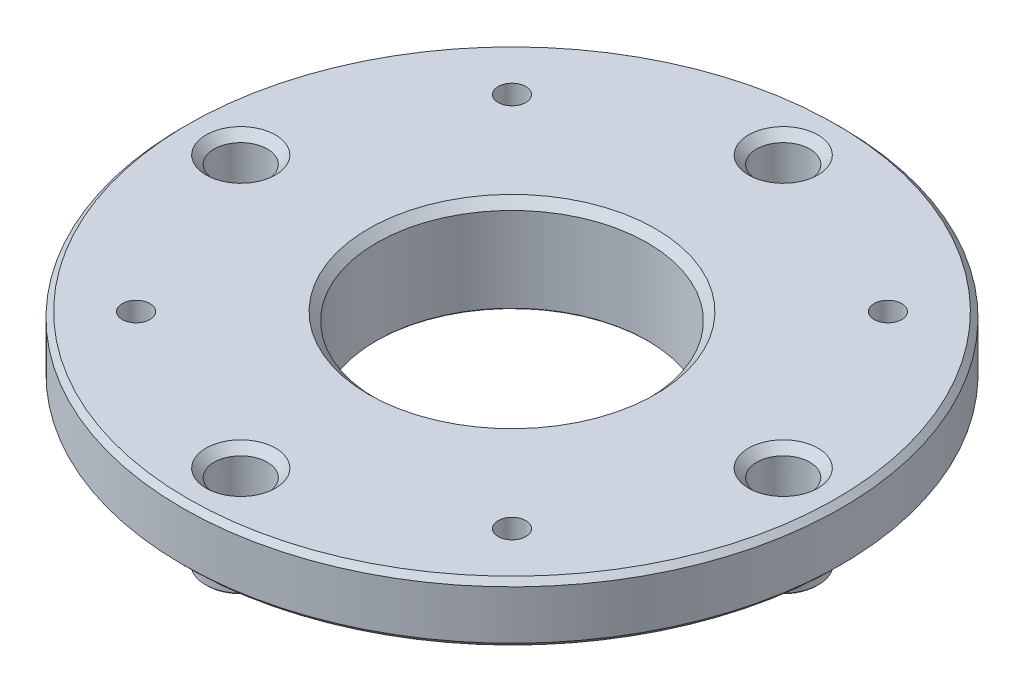
from build123d import *

# Parameters (mm, degrees)
SKETCH1_W                = 60.75
SKETCH1_H                = 11
SKETCH2_R                = 28.485
BOSS_EXTRUDE1_DEPTH      = 6.35
SKETCH3_W                = 6.475
SKETCH3_H                = 4.65
SKETCH4_W                = 6.475
SKETCH4_H                = 4.65
SKETCH5_W                = 6.475
SKETCH5_H                = 4.65
SKETCH6_W                = 6.475
SKETCH6_H                = 4.65
HOLE1_D                  = 5.1054
HOLE1_DEPTH              = 17.35
M8_CLEARANCE_HOLE1_D     = 9.8044
M8_CLEARANCE_HOLE1_DEPTH = 17.35
M45_CLEARANCE_HOLE1_D    = 49.911
M8_CLEARANCE_HOLE2_D     = 9.8044
CHAMFER1_SIZE            = 0.25
CHAMFER2_SIZE            = 1
CHAMFER3_SIZE            = 1.5


with BuildPart() as part:
    # Sketch1 → Revolve1 (revolve)
    with BuildSketch(Plane.XY, mode=Mode.PRIVATE) as revolve1_sk:
        with Locations((30.375, 5.5)):
            Rectangle(SKETCH1_W, SKETCH1_H)
    revolve(revolve1_sk.sketch.rotate(Axis((0, 11, 0), (0, -1, 0)), 270), axis=Axis((0, 11, 0), (0, -1, 0)))

    # Sketch2 → Boss-Extrude1 (add)
    with BuildSketch(Plane.XZ):
        with Locations(Location((0, 0, 0), (0, 0, 270))):
            Circle(SKETCH2_R)
    extrude(amount=BOSS_EXTRUDE1_DEPTH)

    # Sketch3 → Revolve2 (revolve)
    with BuildSketch(Plane(origin=(0, 0, 0), x_dir=(-1, 0, 0), z_dir=(0, 0, -1)), mode=Mode.PRIVATE) as revolve2_sk:
        with Locations((46.7625, -2.325)):
            Rectangle(SKETCH3_W, SKETCH3_H)
    revolve(revolve2_sk.sketch.rotate(Axis((-50, -4.65, 0), (0, 1, 0)), 270), axis=Axis((-50, -4.65, 0), (0, 1, 0)))

    # Sketch4 → Revolve3 (revolve)
    with BuildSketch(Plane(origin=(0, 0, -50), x_dir=(-1, 0, 0), z_dir=(0, 0, -1)), mode=Mode.PRIVATE) as revolve3_sk:
        with Locations((-3.2375, -2.325)):
            Rectangle(SKETCH4_W, SKETCH4_H)
    revolve(revolve3_sk.sketch.rotate(Axis((0, -4.65, -50), (0, 1, 0)), 270), axis=Axis((0, -4.65, -50), (0, 1, 0)))

    # Sketch5 → Revolve4 (revolve)
    with BuildSketch(Plane(origin=(0, 0, 0), x_dir=(-1, 0, 0), z_dir=(0, 0, -1)), mode=Mode.PRIVATE) as revolve4_sk:
        with Locations((-53.2375, -2.325)):
            Rectangle(SKETCH5_W, SKETCH5_H)
    revolve(revolve4_sk.sketch.rotate(Axis((50, -4.65, 0), (0, 1, 0)), 270), axis=Axis((50, -4.65, 0), (0, 1, 0)))

    # Sketch6 → Revolve5 (revolve)
    with BuildSketch(Plane(origin=(0, 0, 50), x_dir=(-1, 0, 0), z_dir=(0, 0, -1)), mode=Mode.PRIVATE) as revolve5_sk:
        with Locations((-3.2375, -2.325)):
            Rectangle(SKETCH6_W, SKETCH6_H)
    revolve(revolve5_sk.sketch.rotate(Axis((0, -4.65, 50), (0, 1, 0)), 270), axis=Axis((0, -4.65, 50), (0, 1, 0)))

    # Hole1
    with Locations(Plane(origin=(0, 11, 0), x_dir=(1, 0, 0), z_dir=(0, 1, 0))):
        with Locations((-34.648232278, -34.648232278), (34.648232278, -34.648232278), (34.648232278, 34.648232278), (-34.648232278, 34.648232278)):
            Hole(HOLE1_D / 2, depth=HOLE1_DEPTH)

    # M8 Clearance Hole1
    with Locations(Plane(origin=(0, 11, 0), x_dir=(1, 0, 0), z_dir=(0, 1, 0))):
        with Locations((50, 0), (0, -50), (-50, 0)):
            Hole(M8_CLEARANCE_HOLE1_D / 2, depth=M8_CLEARANCE_HOLE1_DEPTH)

    # M45 Clearance Hole1 (through all)
    with Locations(Plane(origin=(0, 11, 0), x_dir=(1, 0, 0), z_dir=(0, 1, 0))):
        with Locations((0, 0)):
            Hole(M45_CLEARANCE_HOLE1_D / 2)

    # M8 Clearance Hole2 (through all)
    with Locations(Plane(origin=(0, -4.65, 0), x_dir=(-1, 0, 0), z_dir=(0, -1, 0))):
        with Locations((0, 50)):
            Hole(M8_CLEARANCE_HOLE2_D / 2)

    # Chamfer1
    chamfer1_edges = [part.edges().sort_by_distance(p)[0] for p in [
        (-50, -4.65, -6.475),
        (0, -4.65, -56.475),
        (50, -4.65, -6.475),
        (0, -4.65, 43.525),
        (-45.0978, -4.65, 0),
        (4.9022, -4.65, 50),
        (54.9022, -4.65, 0),
        (24.9555, -6.35, 0),
        (-4.9022, -4.65, -50),
    ]]
    chamfer(chamfer1_edges, length=CHAMFER1_SIZE)

    # Chamfer2
    chamfer2_edges = [part.edges().sort_by_distance(p)[0] for p in [
        (0, -6.35, 28.485),
        (0, 0, 60.75),
        (0, 11, 60.75),
    ]]
    chamfer(chamfer2_edges, length=CHAMFER2_SIZE)

    # Chamfer3
    chamfer3_edges = [part.edges().sort_by_distance(p)[0] for p in [
        (-45.0978, 11, 0),
        (4.9022, 11, 50),
        (54.9022, 11, 0),
        (24.9555, 11, 0),
        (-4.9022, 11, -50),
    ]]
    chamfer(chamfer3_edges, length=CHAMFER3_SIZE)


solid = part.part
